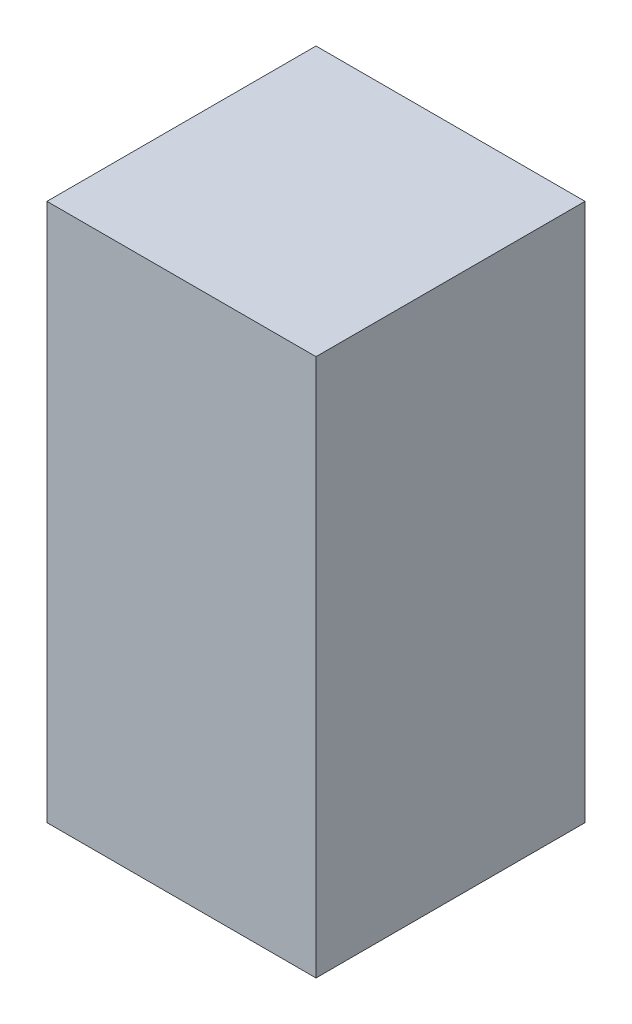
from build123d import *

# Parameters (mm, degrees)
SKETCH1_W           = 12.7
SKETCH1_H           = 25.4
BOSS_EXTRUDE1_DEPTH = 12.7


with BuildPart() as part:
    # Sketch1 → Boss-Extrude1 (new body)
    with BuildSketch(Plane.XY):
        with Locations((6.35, 12.7)):
            Rectangle(SKETCH1_W, SKETCH1_H)
    extrude(amount=BOSS_EXTRUDE1_DEPTH)


solid = part.part
